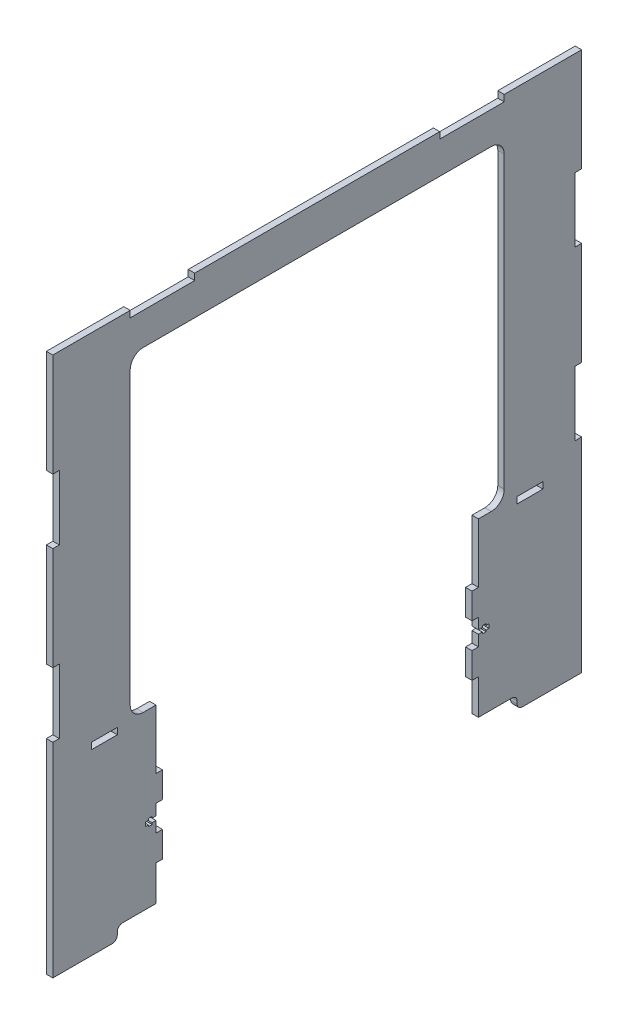
from build123d import *

# Parameters (mm, degrees)
SKETCH_1_W      = 20
SKETCH_1_H      = 5
EXTRUDE_1_DEPTH = 5


with BuildPart() as part:
    # 草图1 → 凸台-拉伸1 (new body)
    with BuildSketch(Plane(origin=(0, 0, 0), x_dir=(0, 0, -1), z_dir=(1, 0, 0))):
        with BuildLine():
            Line((-80, 27), (-80, -19))
            Line((-80, -19), (-85, -19))
            Line((-85, -19), (-85, -39))
            Line((-85, -39), (-80, -39))
            Line((-80, -39), (-80, -47.5))
            Line((-80, -47.5), (-77, -47.5))
            Line((-77, -47.5), (-77, -46.25))
            Line((-77, -46.25), (-74, -46.25))
            Line((-74, -46.25), (-74, -47.5))
            Line((-74, -47.5), (-72, -47.5))
            Line((-72, -47.5), (-72, -50.5))
            Line((-72, -50.5), (-74, -50.5))
            Line((-74, -50.5), (-74, -51.75))
            Line((-74, -51.75), (-77, -51.75))
            Line((-77, -51.75), (-77, -50.5))
            Line((-77, -50.5), (-80, -50.5))
            Line((-80, -50.5), (-80, -59))
            Line((-80, -59), (-85, -59))
            Line((-85, -59), (-85, -79))
            Line((-85, -79), (-80, -79))
            Line((-80, -79), (-80, -90.3))
            Line((-80, -90.3), (-80, -106.3))
            Line((-80, -106.3), (-54, -106.3))
            ThreePointArc((-54, -106.3), (-51.171572875, -107.471572875), (-50, -110.3))
            Line((-50, -110.3), (-50, -112.3))
            ThreePointArc((-50, -112.3), (-48.828427125, -115.128427125), (-46, -116.3))
            Line((-46, -116.3), (0, -116.3))
            Line((0, -116.3), (0, -64.3))
            Line((0, -64.3), (0, 0))
            Line((0, 0), (0, 42))
            Line((0, 42), (-5, 42))
            Line((-5, 42), (-5, 92))
            Line((-5, 92), (0, 92))
            Line((0, 92), (0, 172))
            Line((0, 172), (-5, 172))
            Line((-5, 172), (-5, 222))
            Line((-5, 222), (0, 222))
            Line((0, 222), (0, 302))
            Line((0, 302), (-60, 302))
            Line((-60, 302), (-60, 297))
            Line((-60, 297), (-110, 297))
            Line((-110, 297), (-110, 302))
            Line((-110, 302), (-300, 302))
            Line((-300, 302), (-300, 297))
            Line((-300, 297), (-350, 297))
            Line((-350, 297), (-350, 302))
            Line((-350, 302), (-410, 302))
            Line((-410, 302), (-410, 222))
            Line((-410, 222), (-405, 222))
            Line((-405, 222), (-405, 172))
            Line((-405, 172), (-410, 172))
            Line((-410, 172), (-410, 92))
            Line((-410, 92), (-405, 92))
            Line((-405, 92), (-405, 42))
            Line((-405, 42), (-410, 42))
            Line((-410, 42), (-410, -90.3))
            Line((-410, -90.3), (-410, -116.3))
            Line((-410, -116.3), (-364, -116.3))
            ThreePointArc((-364, -116.3), (-361.171572875, -115.128427125), (-360, -112.3))
            Line((-360, -112.3), (-360, -110.3))
            ThreePointArc((-360, -110.3), (-358.828427125, -107.471572875), (-356, -106.3))
            Line((-356, -106.3), (-330, -106.3))
            Line((-330, -106.3), (-330, -90.3))
            Line((-330, -90.3), (-330, -79))
            Line((-330, -79), (-325, -79))
            Line((-325, -79), (-325, -59))
            Line((-325, -59), (-330, -59))
            Line((-330, -59), (-330, -50.5))
            Line((-330, -50.5), (-333, -50.5))
            Line((-333, -50.5), (-333, -51.75))
            Line((-333, -51.75), (-336, -51.75))
            Line((-336, -51.75), (-336, -50.5))
            Line((-336, -50.5), (-338, -50.5))
            Line((-338, -50.5), (-338, -47.5))
            Line((-338, -47.5), (-336, -47.5))
            Line((-336, -47.5), (-336, -46.25))
            Line((-336, -46.25), (-333, -46.25))
            Line((-333, -46.25), (-333, -47.5))
            Line((-333, -47.5), (-330, -47.5))
            Line((-330, -47.5), (-330, -39))
            Line((-330, -39), (-325, -39))
            Line((-325, -39), (-325, -19))
            Line((-325, -19), (-330, -19))
            Line((-330, -19), (-330, 27))
            Line((-330, 27), (-340, 27))
            ThreePointArc((-340, 27), (-347.071067812, 29.928932188), (-350, 37))
            Line((-350, 37), (-350, 262))
            ThreePointArc((-350, 262), (-347.071067812, 269.071067812), (-340, 272))
            Line((-340, 272), (-70, 272))
            ThreePointArc((-70, 272), (-62.928932188, 269.071067812), (-60, 262))
            Line((-60, 262), (-60, 37))
            ThreePointArc((-60, 37), (-62.928932188, 29.928932188), (-70, 27))
            Line((-70, 27), (-80, 27))
        make_face()
        with Locations((-40, 24.5)):
            Rectangle(SKETCH_1_W, SKETCH_1_H, mode=Mode.SUBTRACT)
        with Locations((-370, 24.5)):
            Rectangle(SKETCH_1_W, SKETCH_1_H, mode=Mode.SUBTRACT)
    extrude(amount=EXTRUDE_1_DEPTH)


solid = part.part
